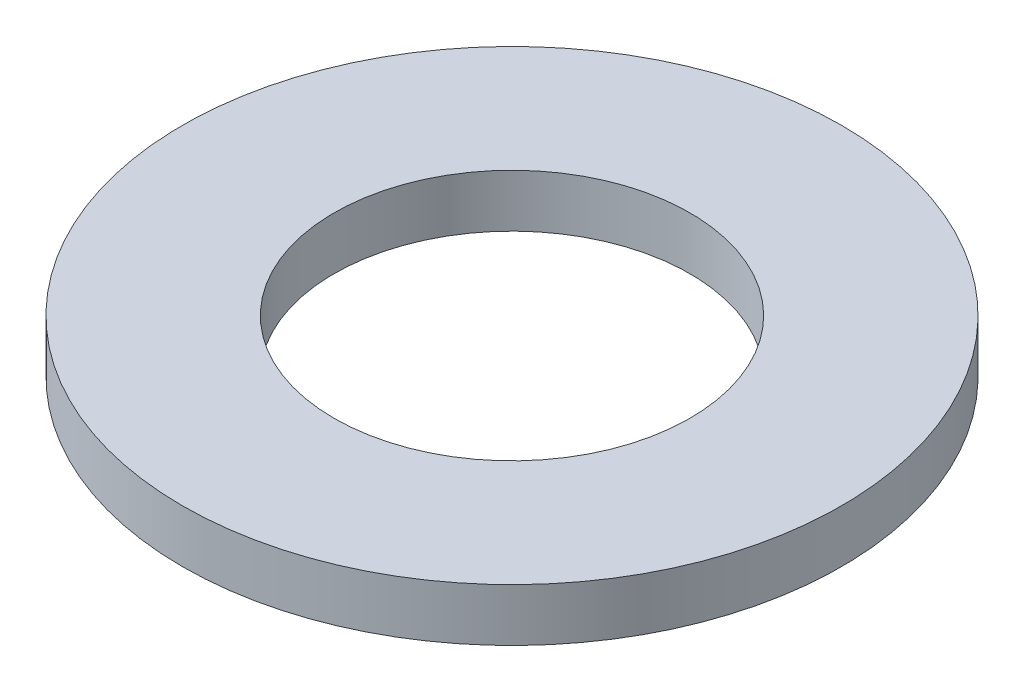
from build123d import *

# Parameters (mm, degrees)
SKETCH1_R           = 12.5
SKETCH1_R_2         = 6.75
BOSS_EXTRUDE1_DEPTH = 2


with BuildPart() as part:
    # Sketch1 → Boss-Extrude1 (new body)
    with BuildSketch(Plane(origin=(0, 0, 0), x_dir=(1, 0, 0), z_dir=(0, 1, 0))):
        with Locations(Location((0, 0, 0), (0, 0, 270))):
            Circle(SKETCH1_R)
        with Locations(Location((0, 0, 0), (0, 0, 270))):
            Circle(SKETCH1_R_2, mode=Mode.SUBTRACT)
    extrude(amount=BOSS_EXTRUDE1_DEPTH)


solid = part.part
